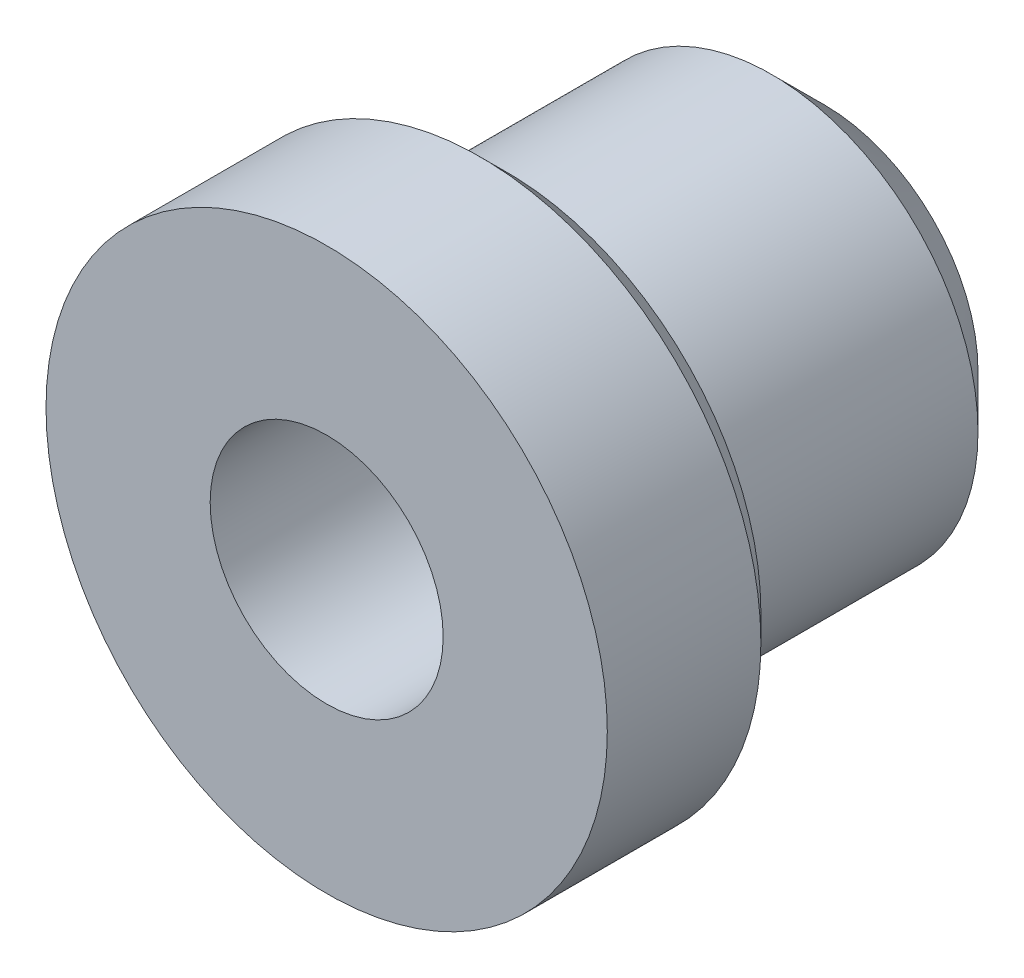
from build123d import *

# Parameters (mm, degrees)
BOSS_EXTRUDE1_START = 1
SKETCH1_R           = 3.9
SKETCH1_R_2         = 1.4
BOSS_EXTRUDE1_DEPTH = 6
SKETCH2_R           = 5.3
SKETCH2_R_2         = 1.4
BOSS_EXTRUDE2_DEPTH = 3.4
CHAMFER1_SIZE       = 0.5
SKETCH3_R           = 2.2
CUT_EXTRUDE1_DEPTH  = 3.2
CHAMFER2_SIZE       = 1


with BuildPart() as part:
    # Sketch1 → Boss-Extrude1 (new body)
    with BuildSketch(Plane.XY.offset(BOSS_EXTRUDE1_START)):
        with Locations(Location((10.044784941, -1.265818107, 0), (0, 0, 180))):
            Circle(SKETCH1_R)
        with Locations(Location((10.044784941, -1.265818107, 0), (0, 0, 180))):
            Circle(SKETCH1_R_2, mode=Mode.SUBTRACT)
    extrude(amount=BOSS_EXTRUDE1_DEPTH)

    # Sketch2 → Boss-Extrude2 (add)
    with BuildSketch(Plane.XY.offset(7)):
        with Locations((10.044784941, -1.265818107)):
            Circle(SKETCH2_R)
        with Locations((10.044784941, -1.265818107)):
            Circle(SKETCH2_R_2, mode=Mode.SUBTRACT)
    extrude(amount=BOSS_EXTRUDE2_DEPTH)

    # Chamfer1
    chamfer1_edges = [part.edges().sort_by_distance(p)[0] for p in [
        (4.744784941, -1.265818107, 7),
    ]]
    chamfer(chamfer1_edges, length=CHAMFER1_SIZE)

    # Sketch3 → Cut-Extrude1 (cut)
    with BuildSketch(Plane.XY.offset(10.4)):
        with Locations((10.044784941, -1.265818107)):
            Circle(SKETCH3_R)
    extrude(amount=-CUT_EXTRUDE1_DEPTH, mode=Mode.SUBTRACT)

    # Chamfer2
    chamfer2_edges = [part.edges().sort_by_distance(p)[0] for p in [
        (13.944784941, -1.265818107, 1),
    ]]
    chamfer(chamfer2_edges, length=CHAMFER2_SIZE)


solid = part.part
